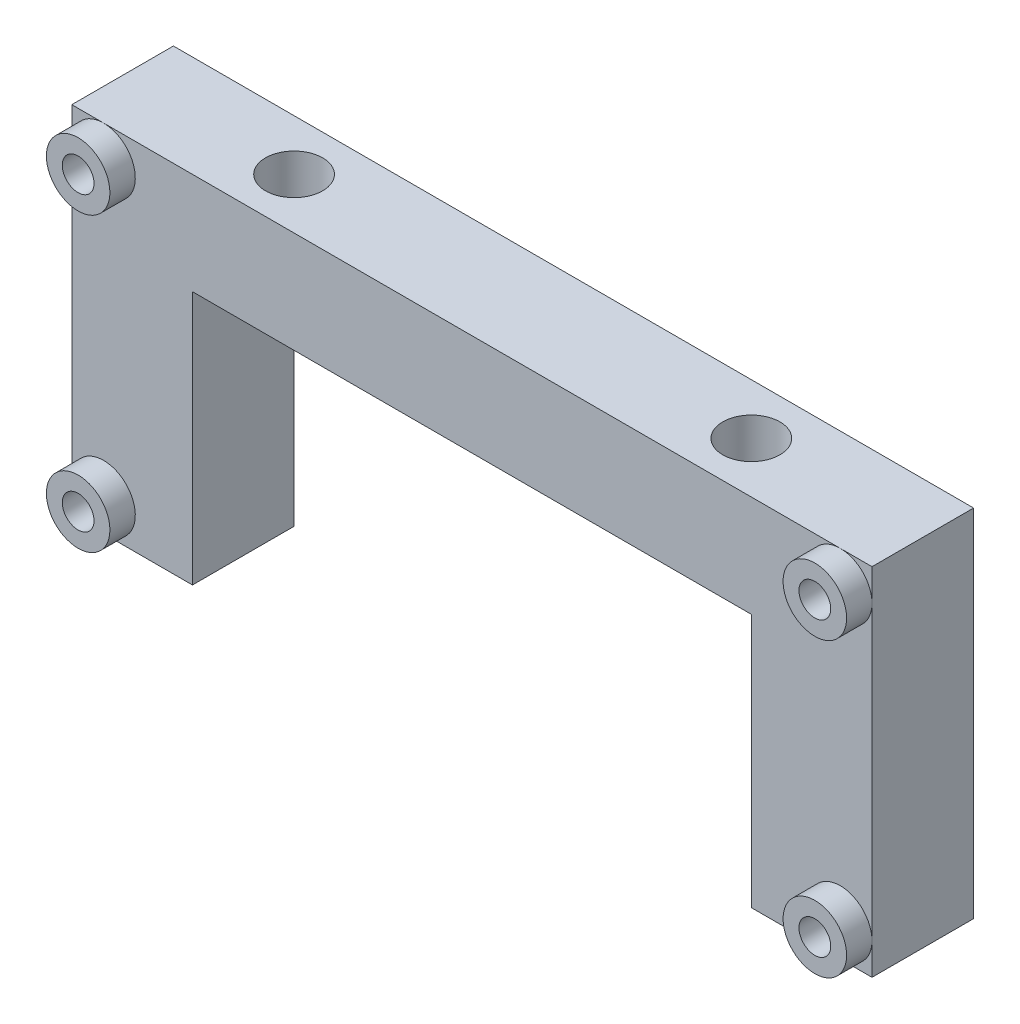
from build123d import *

# Parameters (mm, degrees)
SCHIZZO1_W                   = 28
SCHIZZO1_H                   = 39
ESTRUSIONE_ESTRUSIONE1_DEPTH = 8
SCHIZZO2_R                   = 1.75
TAGLIO_ESTRUSIONE1_DEPTH     = 20
ESTRUSIONE_ESTRUSIONE2_DEPTH = 8
SCHIZZO4_R                   = 2.5
SCHIZZO4_R_2                 = 1.25
ESTRUSIONE_ESTRUSIONE3_DEPTH = 2
SCHIZZO5_R                   = 1.25
TAGLIO_ESTRUSIONE2_DEPTH     = 78.144345224
SCHIZZO6_W                   = 28
SCHIZZO6_H                   = 8
TAGLIO_ESTRUSIONE3_DEPTH     = 10
SCHIZZO7_W                   = 28
SCHIZZO7_H                   = 8
ESTRUSIONE_ESTRUSIONE4_DEPTH = 8
SCHIZZO8_W                   = 44
SCHIZZO8_H                   = 47
TAGLIO_ESTRUSIONE4_DEPTH     = 8
SCHIZZO9_R                   = 2.25
TAGLIO_ESTRUSIONE5_DEPTH     = 8


with BuildPart() as part:
    # Schizzo1 → Estrusione-Estrusione1 (new body)
    with BuildSketch(Plane.XY):
        Polygon((0, 0), (0, 55), (44, 55), (44, 0), (36, 0), (8, 0), align=None)
        with Locations((22, 27.5)):
            Rectangle(SCHIZZO1_W, SCHIZZO1_H, mode=Mode.SUBTRACT)
    extrude(amount=ESTRUSIONE_ESTRUSIONE1_DEPTH)

    # Schizzo2 → Taglio-Estrusione1 (cut)
    with BuildSketch(Plane.XZ):
        with Locations((4, 4)):
            Circle(SCHIZZO2_R)
        with Locations((40, 4)):
            Circle(SCHIZZO2_R)
    extrude(amount=-TAGLIO_ESTRUSIONE1_DEPTH, mode=Mode.SUBTRACT)

    # Schizzo3 → Estrusione-Estrusione2 (add)
    with BuildSketch(Plane.XY.offset(8)):
        Polygon((-9.5, 55), (53.5, 55), (53.5, 27), (36, 27), (36, 47), (8, 47), (8, 27), (-9.5, 27), align=None)
    extrude(amount=-ESTRUSIONE_ESTRUSIONE2_DEPTH)

    # Schizzo4 → Estrusione-Estrusione3 (add)
    # profile 1 of 4: a face of its own
    with BuildSketch(Plane.XY.offset(8)):
        with Locations(Location((-7, 52.5, 0), (0, 0, 180))):
            Circle(SCHIZZO4_R)
        with Locations((-7, 52.5)):
            Circle(SCHIZZO4_R_2, mode=Mode.SUBTRACT)
    # profile 2 of 4: a face of its own
    with BuildSketch(Plane.XY.offset(8)):
        with Locations(Location((-7, 29.5, 0), (0, 0, 180))):
            Circle(SCHIZZO4_R)
        with Locations((-7, 29.5)):
            Circle(SCHIZZO4_R_2, mode=Mode.SUBTRACT)
    # profile 3 of 4: a face of its own
    with BuildSketch(Plane.XY.offset(8)):
        with Locations((51, 29.5)):
            Circle(SCHIZZO4_R)
        with Locations((51, 29.5)):
            Circle(SCHIZZO4_R_2, mode=Mode.SUBTRACT)
    # profile 4 of 4: a face of its own
    with BuildSketch(Plane.XY.offset(8)):
        with Locations((51, 52.5)):
            Circle(SCHIZZO4_R)
        with Locations((51, 52.5)):
            Circle(SCHIZZO4_R_2, mode=Mode.SUBTRACT)
    extrude(amount=ESTRUSIONE_ESTRUSIONE3_DEPTH)

    # Schizzo5 → Taglio-Estrusione2 (cut, through all)
    with BuildSketch(Plane.XY.offset(8)):
        with Locations((-7, 52.5)):
            Circle(SCHIZZO5_R)
        with Locations((-7, 29.5)):
            Circle(SCHIZZO5_R)
        with Locations((51, 52.5)):
            Circle(SCHIZZO5_R)
        with Locations((51, 29.5)):
            Circle(SCHIZZO5_R)
    extrude(amount=-TAGLIO_ESTRUSIONE2_DEPTH, mode=Mode.SUBTRACT)

    # Schizzo6 → Taglio-Estrusione3 (cut)
    with BuildSketch(Plane.XY.offset(8)):
        with Locations((22, 51)):
            Rectangle(SCHIZZO6_W, SCHIZZO6_H)
    extrude(amount=-TAGLIO_ESTRUSIONE3_DEPTH, mode=Mode.SUBTRACT)

    # Schizzo7 → Estrusione-Estrusione4 (add)
    with BuildSketch(Plane.XY.offset(8)):
        with Locations((22, 51)):
            Rectangle(SCHIZZO7_W, SCHIZZO7_H)
    extrude(amount=-ESTRUSIONE_ESTRUSIONE4_DEPTH)

    # Schizzo8 → Taglio-Estrusione4 (cut)
    with BuildSketch(Plane.XY.offset(8)):
        with Locations((22, 23.5)):
            Rectangle(SCHIZZO8_W, SCHIZZO8_H)
    extrude(amount=-TAGLIO_ESTRUSIONE4_DEPTH, mode=Mode.SUBTRACT)

    # Schizzo9 → Taglio-Estrusione5 (cut)
    with BuildSketch(Plane.XZ.offset(-47)):
        with Locations(Location((4, 4, 0), (0, 0, 270))):
            Circle(SCHIZZO9_R)
        with Locations(Location((40, 4, 0), (0, 0, 270))):
            Circle(SCHIZZO9_R)
    extrude(amount=-TAGLIO_ESTRUSIONE5_DEPTH, mode=Mode.SUBTRACT)


solid = part.part
